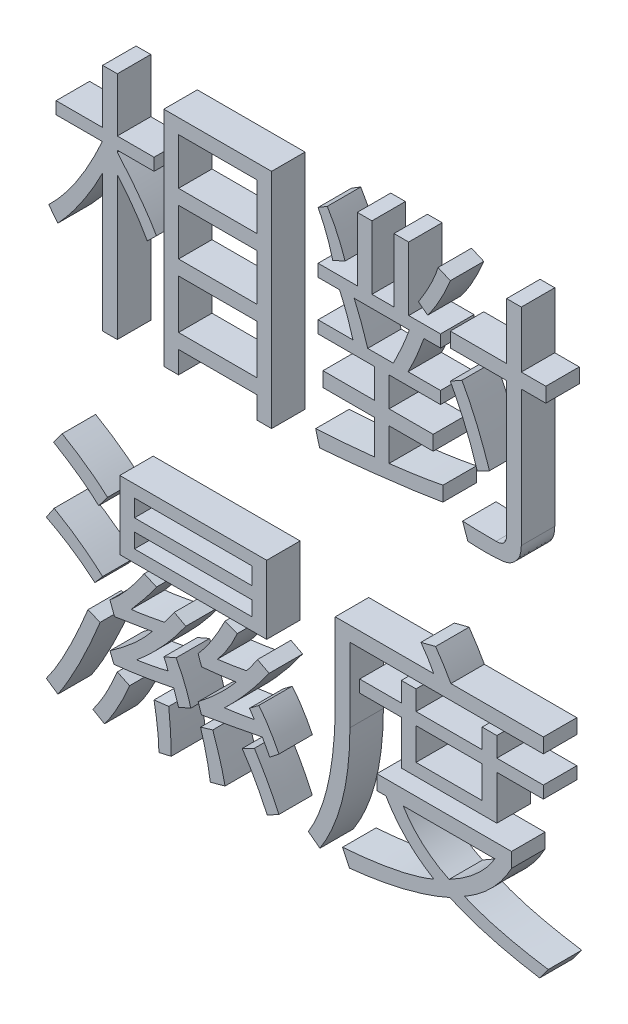
from build123d import *

# Parameters (mm, degrees)
EXTRUDE_1_DEPTH    = 3
SKETCH_2_W         = 7.024390244
SKETCH_2_H         = 4.170731708
SKETCH_2_H_2       = 4.390243903
EXTRUDE_1_2_DEPTH  = 3
EXTRUDE_1_3_DEPTH  = 3
EXTRUDE_1_4_DEPTH  = 3
EXTRUDE_1_5_DEPTH  = 3
EXTRUDE_1_6_DEPTH  = 3
EXTRUDE_1_7_DEPTH  = 3
EXTRUDE_1_8_DEPTH  = 3
SKETCH_2_W_2       = 13.170731708
SKETCH_2_H_3       = 6.146341463
SKETCH_2_W_3       = 10.536585366
SKETCH_2_H_4       = 1.536585365
SKETCH_2_H_5       = 1.317073171
EXTRUDE_1_9_DEPTH  = 3
EXTRUDE_1_10_DEPTH = 3
EXTRUDE_1_11_DEPTH = 3
EXTRUDE_1_12_DEPTH = 3
EXTRUDE_1_13_DEPTH = 3
EXTRUDE_1_14_DEPTH = 3
EXTRUDE_1_15_DEPTH = 3
EXTRUDE_1_16_DEPTH = 3
EXTRUDE_1_17_DEPTH = 3
EXTRUDE_1_18_DEPTH = 3
SKETCH_2_W_4       = 5.926829268
SKETCH_2_H_6       = 2.853658537
EXTRUDE_1_19_DEPTH = 3
EXTRUDE_1_20_DEPTH = 3


with BuildPart() as part:
    # 草圖2 → 填料-伸長1 (new body)
    with BuildSketch(Plane.XY):
        with BuildLine():
            Line((11.195121951, 8.492378049), (10.37195122, 7.682926829))
            add(Edge.make_bspline(
                [(10.37195122, 7.682926829), (10.194001007, 7.995110736), (9.828654537, 8.636050058), (9.192617307, 9.575460859), (8.478376217, 10.530055372), (7.952666495, 11.150939105), (7.682926829, 11.469512195)],
                knots=[0, 0, 0, 0, 0.926494149, 1.902168946, 2.923610835, 4, 4, 4, 4], degree=3))
            Line((7.682926829, 11.469512195), (7.682926829, -1.317073171))
            Line((7.682926829, -1.317073171), (6.365853659, -1.317073171))
            Line((6.365853659, -1.317073171), (6.365853659, 10.955030488))
            add(Edge.make_bspline(
                [(6.365853659, 10.955030488), (6.215695345, 10.664757037), (5.919445146, 10.092071011), (5.448191947, 9.262177755), (4.965376822, 8.468777478), (4.466566618, 7.714189973), (3.959301962, 6.9922869), (3.439571365, 6.306551586), (2.903589275, 5.659115278), (2.530613952, 5.250831327), (2.346036585, 5.048780488)],
                knots=[0, 0, 0, 0, 1.09419143, 2.15875114, 3.194770078, 4.203431801, 5.186928088, 6.148575884, 7.083770513, 8, 8, 8, 8], degree=3))
            Line((2.346036585, 5.048780488), (1.536585366, 6.091463415))
            add(Edge.make_bspline(
                [(1.536585366, 6.091463415), (1.759917396, 6.316467103), (2.215687975, 6.775649163), (2.861543167, 7.525851201), (3.491437342, 8.340136735), (4.094833622, 9.224938723), (4.691759287, 10.168014651), (5.261391283, 11.182375763), (5.819159698, 12.259265922), (6.165245336, 13.008121113), (6.341844512, 13.390243902)],
                knots=[0, 0, 0, 0, 0.865432811, 1.76615425, 2.700926786, 3.675112701, 4.689371464, 5.747644892, 6.850677372, 8, 8, 8, 8], degree=3))
            Line((6.341844512, 13.390243902), (2.195121951, 13.390243902))
            Line((2.195121951, 13.390243902), (2.195121951, 14.487804878))
            Line((2.195121951, 14.487804878), (6.365853659, 14.487804878))
            Line((6.365853659, 14.487804878), (6.365853659, 19.317073171))
            Line((6.365853659, 19.317073171), (7.682926829, 19.317073171))
            Line((7.682926829, 19.317073171), (7.682926829, 14.487804878))
            Line((7.682926829, 14.487804878), (10.975609756, 14.487804878))
            Line((10.975609756, 14.487804878), (10.975609756, 13.390243902))
            Line((10.975609756, 13.390243902), (7.682926829, 13.390243902))
            Line((7.682926829, 13.390243902), (7.682926829, 13.225609756))
            add(Edge.make_bspline(
                [(7.682926829, 13.225609756), (7.867915933, 13.013746523), (8.230737255, 12.598216651), (8.749747103, 11.972489826), (9.234615126, 11.358953316), (9.694165494, 10.763026288), (10.1136308, 10.175919212), (10.507113856, 9.605772744), (10.868089211, 9.048616748), (11.087786379, 8.674941418), (11.195121951, 8.492378049)],
                knots=[0, 0, 0, 0, 1.143459145, 2.242679984, 3.304712972, 4.322704541, 5.301803685, 6.237830081, 7.139071671, 8, 8, 8, 8], degree=3))
        make_face()
    extrude(amount=EXTRUDE_1_DEPTH)


with BuildPart() as body_2:
    # 草圖2 → Extrude 1 2 (new body)
    with BuildSketch(Plane.XY):
        Polygon((21.512195122, -1.317073171), (20.195121951, -1.317073171), (20.195121951, 0.658536585), (13.170731707, 0.658536585), (13.170731707, -1.317073171), (11.853658537, -1.317073171), (11.853658537, 18.658536585), (21.512195122, 18.658536585), align=None)
        with Locations((16.682926829, 15.256097561)):
            Rectangle(SKETCH_2_W, SKETCH_2_H, mode=Mode.SUBTRACT)
        with Locations((16.682926829, 9.768292683)):
            Rectangle(SKETCH_2_W, SKETCH_2_H, mode=Mode.SUBTRACT)
        with Locations((16.682926829, 4.170731708)):
            Rectangle(SKETCH_2_W, SKETCH_2_H_2, mode=Mode.SUBTRACT)
    extrude(amount=EXTRUDE_1_2_DEPTH)


with BuildPart() as body_3:
    # 草圖2 → Extrude 1 3 (new body)
    with BuildSketch(Plane.XY):
        with BuildLine():
            add(Edge.make_bspline(
                [(36.87804878, 0.658536585), (36.479239613, 0.592109643), (35.664311248, 0.456372544), (34.413150927, 0.272757679), (33.109447277, 0.098721548), (31.753467888, -0.069606956), (30.344788428, -0.230068855), (28.883781703, -0.384994037), (27.370008335, -0.529462451), (26.342700315, -0.615016395), (25.820121951, -0.658536585)],
                knots=[0, 0, 0, 0, 0.871065814, 1.779939626, 2.724368522, 3.704811522, 4.72380686, 5.778991205, 6.870201418, 8, 8, 8, 8], degree=3))
            Line((25.820121951, -0.658536585), (25.463414634, 0.658536585))
            add(Edge.make_bspline(
                [(25.463414634, 0.658536585), (25.870473505, 0.684110794), (26.706615328, 0.736642914), (27.992053677, 0.831510617), (29.340832205, 0.953832667), (30.260731458, 1.044355014), (30.731707317, 1.09070122)],
                knots=[0, 0, 0, 0, 0.92583437, 1.90176137, 2.925730468, 4, 4, 4, 4], degree=3))
            Line((30.731707317, 1.09070122), (30.731707317, 4.170731707))
            Line((30.731707317, 4.170731707), (26.12195122, 4.170731707))
            Line((26.12195122, 4.170731707), (26.12195122, 5.487804878))
            Line((26.12195122, 5.487804878), (30.731707317, 5.487804878))
            Line((30.731707317, 5.487804878), (30.731707317, 8.12195122))
            Line((30.731707317, 8.12195122), (25.682926829, 8.12195122))
            Line((25.682926829, 8.12195122), (25.682926829, 9.219512195))
            Line((25.682926829, 9.219512195), (28.81097561, 9.219512195))
            add(Edge.make_bspline(
                [(28.81097561, 9.219512195), (28.722233505, 9.522215625), (28.549049417, 10.112954568), (28.250347401, 10.962153868), (27.946901845, 11.761759944), (27.716095311, 12.266373839), (27.603658537, 12.512195122)],
                knots=[0, 0, 0, 0, 1.078020835, 2.10380467, 3.076273615, 4, 4, 4, 4], degree=3))
            Line((27.603658537, 12.512195122), (25.682926829, 12.512195122))
            Line((25.682926829, 12.512195122), (25.682926829, 13.609756098))
            Line((25.682926829, 13.609756098), (29.195121951, 13.609756098))
            Line((29.195121951, 13.609756098), (29.195121951, 19.317073171))
            Line((29.195121951, 19.317073171), (30.512195122, 19.317073171))
            Line((30.512195122, 19.317073171), (30.512195122, 13.609756098))
            Line((30.512195122, 13.609756098), (32.487804878, 13.609756098))
            Line((32.487804878, 13.609756098), (32.487804878, 19.317073171))
            Line((32.487804878, 19.317073171), (33.804878049, 19.317073171))
            Line((33.804878049, 19.317073171), (33.804878049, 13.609756098))
            Line((33.804878049, 13.609756098), (36.658536585, 13.609756098))
            Line((36.658536585, 13.609756098), (36.658536585, 12.512195122))
            Line((36.658536585, 12.512195122), (35.176829268, 12.512195122))
            add(Edge.make_bspline(
                [(35.176829268, 12.512195122), (35.072202937, 12.23256672), (34.863030097, 11.673523249), (34.518148298, 10.845603445), (34.149237498, 10.026346651), (33.883122969, 9.488545537), (33.75, 9.219512195)],
                knots=[0, 0, 0, 0, 0.997752604, 1.994744001, 2.996876897, 4, 4, 4, 4], degree=3))
            Line((33.75, 9.219512195), (36.658536585, 9.219512195))
            Line((36.658536585, 9.219512195), (36.658536585, 8.12195122))
            Line((36.658536585, 8.12195122), (32.048780488, 8.12195122))
            Line((32.048780488, 8.12195122), (32.048780488, 5.487804878))
            Line((32.048780488, 5.487804878), (36, 5.487804878))
            Line((36, 5.487804878), (36, 4.170731707))
            Line((36, 4.170731707), (32.048780488, 4.170731707))
            Line((32.048780488, 4.170731707), (32.048780488, 1.245045732))
            add(Edge.make_bspline(
                [(32.048780488, 1.245045732), (32.433165458, 1.288913096), (33.215646696, 1.378212605), (34.404286369, 1.549722353), (35.631027102, 1.742115455), (36.457681907, 1.896899601), (36.87804878, 1.975609756)],
                knots=[0, 0, 0, 0, 0.950226922, 1.934349145, 2.949584292, 4, 4, 4, 4], degree=3))
            Line((36.87804878, 1.975609756), (36.87804878, 0.658536585))
        make_face()
        with BuildLine():
            Line((33.859756098, 12.512195122), (28.920731707, 12.512195122))
            add(Edge.make_bspline(
                [(28.920731707, 12.512195122), (29.028453625, 12.258959869), (29.247963514, 11.742930785), (29.557869177, 10.940732841), (29.850643317, 10.095390577), (30.034489589, 9.514915436), (30.12804878, 9.219512195)],
                knots=[0, 0, 0, 0, 0.941091742, 1.917705787, 2.940322478, 4, 4, 4, 4], degree=3))
            Line((30.12804878, 9.219512195), (32.432926829, 9.219512195))
            add(Edge.make_bspline(
                [(32.432926829, 9.219512195), (32.584264269, 9.52974749), (32.873128727, 10.121907307), (33.262226073, 10.981368871), (33.590573188, 11.767604059), (33.773533973, 12.273694753), (33.859756098, 12.512195122)],
                knots=[0, 0, 0, 0, 1.153513399, 2.201762002, 3.152562119, 4, 4, 4, 4], degree=3))
        make_face(mode=Mode.SUBTRACT)
    extrude(amount=EXTRUDE_1_3_DEPTH)


with BuildPart() as body_4:
    # 草圖2 → Extrude 1 4 (new body)
    with BuildSketch(Plane.XY):
        with BuildLine():
            Line((46.097560976, 12.951219512), (43.902439024, 12.951219512))
            Line((43.902439024, 12.951219512), (43.902439024, 0.795731707))
            add(Edge.make_bspline(
                [(43.902439024, 0.795731707), (43.89874847, 0.663798036), (43.891715468, 0.412375126), (43.813850742, 0.057097246), (43.692685574, -0.257432277), (43.516873076, -0.522584136), (43.315622187, -0.744710865), (43.096501316, -0.924349749), (42.868006095, -1.069918931), (42.658115071, -1.154666328), (42.470236451, -1.204835945), (42.298050304, -1.234793709), (42.093866371, -1.256397329), (41.858680139, -1.282303045), (41.590878487, -1.298316512), (41.291212997, -1.307597972), (40.959633148, -1.314612526), (40.727518967, -1.31622911), (40.60632622, -1.317073171)],
                knots=[0, 0, 0, 0, 1.393959343, 2.656435708, 3.829226923, 4.940030392, 6.002126219, 6.990473935, 7.930543058, 8.858465568, 9.372067435, 9.986739113, 10.705586259, 11.54470175, 12.490360102, 13.543598056, 14.717449747, 16, 16, 16, 16], degree=3))
            add(Edge.make_bspline(
                [(40.60632622, -1.317073171), (40.346680538, -1.315475135), (39.846411552, -1.312396141), (39.347459424, -1.276183219), (39.107469512, -1.258765244)],
                knots=[0, 0, 0, 0, 1.038024297, 2, 2, 2, 2], degree=3))
            Line((39.107469512, -1.258765244), (38.634146341, 0.068597561))
            add(Edge.make_bspline(
                [(38.634146341, 0.068597561), (38.846761388, 0.057371155), (39.29696043, 0.033599945), (40.011742263, 0.015883439), (40.801762821, 0.000619343), (41.354029714, 0.000212337), (41.64214939, 0)],
                knots=[0, 0, 0, 0, 0.849009304, 1.797724023, 2.851064495, 4, 4, 4, 4], degree=3))
            add(Edge.make_bspline(
                [(41.64214939, 0), (41.715719876, 0.001550386), (41.855516521, 0.004496388), (42.049685822, 0.055650379), (42.220232086, 0.127261484), (42.353482251, 0.243273481), (42.459665489, 0.384276048), (42.535865329, 0.557498863), (42.579177844, 0.761595121), (42.583232144, 0.907557455), (42.585365854, 0.984375)],
                knots=[0, 0, 0, 0, 1.126045964, 2.139682047, 3.066887442, 3.939260296, 4.817270513, 5.760467651, 6.821371433, 8, 8, 8, 8], degree=3))
            Line((42.585365854, 0.984375), (42.585365854, 12.951219512))
            Line((42.585365854, 12.951219512), (37.536585366, 12.951219512))
            Line((37.536585366, 12.951219512), (37.536585366, 14.268292683))
            Line((37.536585366, 14.268292683), (42.585365854, 14.268292683))
            Line((42.585365854, 14.268292683), (42.585365854, 19.317073171))
            Line((42.585365854, 19.317073171), (43.902439024, 19.317073171))
            Line((43.902439024, 19.317073171), (43.902439024, 14.268292683))
            Line((43.902439024, 14.268292683), (46.097560976, 14.268292683))
            Line((46.097560976, 14.268292683), (46.097560976, 12.951219512))
        make_face()
    extrude(amount=EXTRUDE_1_4_DEPTH)


with BuildPart() as body_5:
    # 草圖2 → Extrude 1 5 (new body)
    with BuildSketch(Plane.XY):
        with BuildLine():
            add(Edge.make_bspline(
                [(37.536585366, 18.181783537), (37.393225684, 17.841483376), (37.111468153, 17.172661207), (36.624266309, 16.216216026), (36.097284623, 15.318753538), (35.701054348, 14.761828266), (35.506097561, 14.487804878)],
                knots=[0, 0, 0, 0, 1.048181086, 2.060083505, 3.045504817, 4, 4, 4, 4], degree=3))
            Line((35.506097561, 14.487804878), (34.682926829, 15.115472561))
            add(Edge.make_bspline(
                [(34.682926829, 15.115472561), (34.790381826, 15.285131256), (34.999827137, 15.615820563), (35.286869763, 16.110202132), (35.546893211, 16.584587488), (35.786635769, 17.034315201), (35.987126618, 17.469388445), (36.167523279, 17.88093305), (36.320356596, 18.273769925), (36.400440084, 18.533431415), (36.43902439, 18.658536585)],
                knots=[0, 0, 0, 0, 1.215130635, 2.368465142, 3.458389289, 4.488834968, 5.451365271, 6.356147849, 7.20799036, 8, 8, 8, 8], degree=3))
            Line((36.43902439, 18.658536585), (37.536585366, 18.181783537))
        make_face()
    extrude(amount=EXTRUDE_1_5_DEPTH)


with BuildPart() as body_6:
    # 草圖2 → Extrude 1 6 (new body)
    with BuildSketch(Plane.XY):
        with BuildLine():
            Line((28.097560976, 14.985137195), (27, 14.487804878))
            add(Edge.make_bspline(
                [(27, 14.487804878), (26.917764724, 14.788419731), (26.753744958, 15.388001574), (26.446077837, 16.264685579), (26.094883421, 17.119219593), (25.820136532, 17.66775252), (25.682926829, 17.941692073)],
                knots=[0, 0, 0, 0, 1.009354514, 2.013176112, 3.007772146, 4, 4, 4, 4], degree=3))
            Line((25.682926829, 17.941692073), (26.506097561, 18.43902439))
            add(Edge.make_bspline(
                [(26.506097561, 18.43902439), (26.66597493, 18.169879825), (26.987265848, 17.629004623), (27.412106667, 16.780899391), (27.783062226, 15.89720013), (27.992270199, 15.29048599), (28.097560976, 14.985137195)],
                knots=[0, 0, 0, 0, 0.985279188, 1.980025419, 2.983381524, 4, 4, 4, 4], degree=3))
        make_face()
    extrude(amount=EXTRUDE_1_6_DEPTH)


with BuildPart() as body_7:
    # 草圖2 → Extrude 1 7 (new body)
    with BuildSketch(Plane.XY):
        with BuildLine():
            Line((41.048780488, 5.179115854), (39.951219512, 4.609756098))
            add(Edge.make_bspline(
                [(39.951219512, 4.609756098), (39.799297043, 5.094275082), (39.49277485, 6.071851493), (38.920236977, 7.514672907), (38.282417195, 8.962844479), (37.786865716, 9.905931038), (37.536585366, 10.382240854)],
                knots=[0, 0, 0, 0, 0.971873337, 1.960873523, 2.970130635, 4, 4, 4, 4], degree=3))
            Line((37.536585366, 10.382240854), (38.579268293, 10.975609756))
            add(Edge.make_bspline(
                [(38.579268293, 10.975609756), (38.686623969, 10.781809619), (38.907212814, 10.383599204), (39.226462107, 9.760176378), (39.535346156, 9.093066827), (39.851476299, 8.390140547), (40.151182545, 7.642392048), (40.461226187, 6.859530137), (40.756023754, 6.032828235), (40.949912666, 5.467425818), (41.048780488, 5.179115854)],
                knots=[0, 0, 0, 0, 0.842606769, 1.73134444, 2.663122562, 3.638416779, 4.662315381, 5.726598791, 6.840747397, 8, 8, 8, 8], degree=3))
        make_face()
    extrude(amount=EXTRUDE_1_7_DEPTH)


with BuildPart() as body_8:
    # 草圖2 → Extrude 1 8 (new body)
    with BuildSketch(Plane.XY):
        with BuildLine():
            Line((6.804878049, -14.006097561), (6.016006098, -15.048780488))
            add(Edge.make_bspline(
                [(6.016006098, -15.048780488), (5.895685002, -14.936910658), (5.645839613, -14.704614225), (5.240864995, -14.363749041), (4.796502529, -14.013374166), (4.313142114, -13.651959296), (3.784045473, -13.287983824), (3.219093738, -12.910187991), (2.613155357, -12.524526019), (2.192245081, -12.270821356), (1.975609756, -12.140243902)],
                knots=[0, 0, 0, 0, 0.790397559, 1.641251557, 2.545903749, 3.512977392, 4.544534932, 5.635403711, 6.782982706, 8, 8, 8, 8], degree=3))
            Line((1.975609756, -12.140243902), (2.740472561, -11.097560976))
            add(Edge.make_bspline(
                [(2.740472561, -11.097560976), (3.131847794, -11.331200457), (3.891441595, -11.784655571), (4.954330216, -12.513844259), (5.928662336, -13.23811268), (6.518751932, -13.75531396), (6.804878049, -14.006097561)],
                knots=[0, 0, 0, 0, 1.09226414, 2.11990182, 3.088366926, 4, 4, 4, 4], degree=3))
        make_face()
    extrude(amount=EXTRUDE_1_8_DEPTH)


with BuildPart() as body_9:
    # 草圖2 → Extrude 1 9 (new body)
    with BuildSketch(Plane.XY):
        with Locations((14.487804878, -14.829268293)):
            Rectangle(SKETCH_2_W_2, SKETCH_2_H_3)
        with Locations((14.487804878, -13.62195122)):
            Rectangle(SKETCH_2_W_3, SKETCH_2_H_4, mode=Mode.SUBTRACT)
        with Locations((14.487804878, -16.146341464)):
            Rectangle(SKETCH_2_W_3, SKETCH_2_H_5, mode=Mode.SUBTRACT)
    extrude(amount=EXTRUDE_1_9_DEPTH)


with BuildPart() as body_10:
    # 草圖2 → Extrude 1 10 (new body)
    with BuildSketch(Plane.XY):
        with BuildLine():
            Line((6.365853659, -20.37195122), (5.669588415, -21.195121951))
            add(Edge.make_bspline(
                [(5.669588415, -21.195121951), (5.34266575, -20.921971199), (4.683540255, -20.371258002), (3.622555842, -19.621086691), (2.502574085, -18.914688921), (1.715503577, -18.497682254), (1.317073171, -18.286585366)],
                knots=[0, 0, 0, 0, 0.973940654, 1.963611541, 2.969140539, 4, 4, 4, 4], degree=3))
            Line((1.317073171, -18.286585366), (2.023628049, -17.243902439))
            add(Edge.make_bspline(
                [(2.023628049, -17.243902439), (2.410462708, -17.472874497), (3.181893601, -17.929493663), (4.28872953, -18.689142947), (5.356685602, -19.495819145), (6.029494972, -20.079933818), (6.365853659, -20.37195122)],
                knots=[0, 0, 0, 0, 1.005963703, 2.006106376, 3.003189505, 4, 4, 4, 4], degree=3))
        make_face()
    extrude(amount=EXTRUDE_1_10_DEPTH)


with BuildPart() as body_11:
    # 草圖2 → Extrude 1 11 (new body)
    with BuildSketch(Plane.XY):
        with BuildLine():
            Line((14.268292683, -26.645198171), (13.170731707, -27.12195122))
            add(Edge.make_bspline(
                [(13.170731707, -27.12195122), (13.130175931, -26.986851776), (13.054378028, -26.734353728), (12.939942123, -26.38525642), (12.842780112, -26.089017729), (12.775703918, -25.912151551), (12.745426829, -25.832317073)],
                knots=[0, 0, 0, 0, 1.246138474, 2.329006878, 3.245741243, 4, 4, 4, 4], degree=3))
            add(Edge.make_bspline(
                [(12.745426829, -25.832317073), (12.289780384, -25.925467503), (11.386429348, -26.110144763), (10.034523774, -26.335028498), (8.703276932, -26.536368529), (7.819350368, -26.634348257), (7.381097561, -26.682926829)],
                knots=[0, 0, 0, 0, 1.027005234, 2.036109911, 3.026298815, 4, 4, 4, 4], degree=3))
            Line((7.381097561, -26.682926829), (7.024390244, -25.804878049))
            add(Edge.make_bspline(
                [(7.024390244, -25.804878049), (7.223226392, -25.665689168), (7.613907099, -25.392205644), (8.170650634, -24.965535427), (8.698556491, -24.543428761), (9.191350708, -24.119939771), (9.648737467, -23.693937638), (10.070676626, -23.267068993), (10.46399082, -22.845044627), (10.70162726, -22.55240456), (10.817835366, -22.40929878)],
                knots=[0, 0, 0, 0, 1.140042612, 2.239998397, 3.294336047, 4.314948586, 5.291554596, 6.229593053, 7.134242047, 8, 8, 8, 8], degree=3))
            Line((10.817835366, -22.40929878), (7.429115854, -22.951219512))
            Line((7.429115854, -22.951219512), (7.024390244, -21.853658537))
            add(Edge.make_bspline(
                [(7.024390244, -21.853658537), (7.152313597, -21.745052012), (7.414656721, -21.522323523), (7.79783094, -21.157989708), (8.180891497, -20.759640102), (8.566276423, -20.330305797), (8.948983289, -19.866741708), (9.334215912, -19.372162714), (9.718438798, -18.842790687), (9.969310834, -18.474739516), (10.097560976, -18.286585366)],
                knots=[0, 0, 0, 0, 0.852319151, 1.74792221, 2.684397488, 3.659152232, 4.677899211, 5.737400043, 6.843319611, 8, 8, 8, 8], degree=3))
            Line((10.097560976, -18.286585366), (11.195121951, -18.773628049))
            add(Edge.make_bspline(
                [(11.195121951, -18.773628049), (11.159096052, -18.832302304), (11.074933034, -18.969375978), (10.913801312, -19.195690905), (10.706272595, -19.47515602), (10.446004087, -19.804440347), (10.142346905, -20.189661197), (9.783284628, -20.623586416), (9.381307352, -21.115020226), (9.090981676, -21.455201443), (8.938262195, -21.634146341)],
                knots=[0, 0, 0, 0, 0.453096944, 1.058516412, 1.827631533, 2.744419089, 3.820990896, 5.056301648, 6.451531779, 8, 8, 8, 8], degree=3))
            add(Edge.make_bspline(
                [(8.938262195, -21.634146341), (9.017181851, -21.627647173), (9.187833605, -21.613593709), (9.462494439, -21.58275179), (9.775404808, -21.536325971), (10.127633629, -21.4819738), (10.518611773, -21.416477587), (10.947298697, -21.340698056), (11.415245567, -21.255496404), (11.739420585, -21.191026189), (11.908536585, -21.157393293)],
                knots=[0, 0, 0, 0, 0.631425652, 1.365361961, 2.20340383, 3.153685227, 4.207324198, 5.364426221, 6.625070808, 8, 8, 8, 8], degree=3))
            add(Edge.make_bspline(
                [(11.908536585, -21.157393293), (11.997958516, -21.038673594), (12.167589286, -20.813465819), (12.403528526, -20.492473664), (12.607394408, -20.20683532), (12.729715531, -20.026881181), (12.786585366, -19.943216463)],
                knots=[0, 0, 0, 0, 1.19014648, 2.257672853, 3.189953014, 4, 4, 4, 4], degree=3))
            Line((12.786585366, -19.943216463), (13.829268293, -20.498856707))
            add(Edge.make_bspline(
                [(13.829268293, -20.498856707), (13.674409408, -20.718534256), (13.364576764, -21.158052312), (12.867406481, -21.794393447), (12.353846024, -22.421842479), (11.810628715, -23.029815793), (11.248344837, -23.629558301), (10.658591051, -24.210049026), (10.047660476, -24.77859228), (9.624343477, -25.142031459), (9.411585366, -25.324695122)],
                knots=[0, 0, 0, 0, 0.982953296, 1.966635754, 2.952910358, 3.948221883, 4.94812618, 5.95943845, 6.974418644, 8, 8, 8, 8], degree=3))
            add(Edge.make_bspline(
                [(9.411585366, -25.324695122), (9.56707735, -25.29957108), (9.867854461, -25.250972198), (10.302726179, -25.180234696), (10.705198944, -25.108095674), (11.073113997, -25.035951746), (11.408554335, -24.968140028), (11.708849342, -24.898800028), (11.978260513, -24.835123564), (12.14533923, -24.787887775), (12.224085366, -24.765625)],
                knots=[0, 0, 0, 0, 1.317536546, 2.54858691, 3.685391053, 4.737587821, 5.68475564, 6.547800657, 7.315561622, 8, 8, 8, 8], degree=3))
            add(Edge.make_bspline(
                [(12.224085366, -24.765625), (12.193572644, -24.671776705), (12.136336043, -24.495733499), (12.05040038, -24.249174772), (11.953115726, -24.043551291), (11.885080603, -23.920430494), (11.853658537, -23.863567073)],
                knots=[0, 0, 0, 0, 1.211754691, 2.273042671, 3.202403625, 4, 4, 4, 4], degree=3))
            Line((11.853658537, -23.863567073), (12.951219512, -23.390243902))
            add(Edge.make_bspline(
                [(12.951219512, -23.390243902), (13.091283222, -23.647802112), (13.371063731, -24.16228061), (13.718693732, -24.969343605), (14.031742022, -25.793174796), (14.189182344, -26.360253466), (14.268292683, -26.645198171)],
                knots=[0, 0, 0, 0, 0.998776884, 1.99507999, 2.992571276, 4, 4, 4, 4], degree=3))
        make_face()
    extrude(amount=EXTRUDE_1_11_DEPTH)


with BuildPart() as body_12:
    # 草圖2 → Extrude 1 12 (new body)
    with BuildSketch(Plane.XY):
        with BuildLine():
            Line((22.170731707, -26.254192073), (21.347560976, -26.902439024))
            Line((21.347560976, -26.902439024), (20.68902439, -25.674542683))
            add(Edge.make_bspline(
                [(20.68902439, -25.674542683), (20.391891489, -25.733492164), (19.817407046, -25.847466617), (18.984030877, -26.001995168), (18.212273827, -26.153099485), (17.499003518, -26.280362285), (16.846749556, -26.402352363), (16.253324972, -26.508425758), (15.719427044, -26.601212096), (15.383037243, -26.65683349), (15.225228659, -26.682926829)],
                knots=[0, 0, 0, 0, 1.308450527, 2.52979212, 3.661039907, 4.705226898, 5.659308597, 6.527258405, 7.309101332, 8, 8, 8, 8], degree=3))
            Line((15.225228659, -26.682926829), (14.937118902, -25.804878049))
            add(Edge.make_bspline(
                [(14.937118902, -25.804878049), (15.250163932, -25.559463233), (15.872295357, -25.071737013), (16.744357185, -24.275884112), (17.577173779, -23.453884345), (18.085991327, -22.866602036), (18.339557927, -22.573932927)],
                knots=[0, 0, 0, 0, 1.015027455, 2.017219306, 3.011891471, 4, 4, 4, 4], degree=3))
            add(Edge.make_bspline(
                [(18.339557927, -22.573932927), (18.244660157, -22.588752856), (18.044645104, -22.619988668), (17.729695775, -22.670088159), (17.384760833, -22.711173581), (17.011390823, -22.761843025), (16.609876899, -22.808246328), (16.178925835, -22.856929713), (15.719293016, -22.904820084), (15.402459783, -22.935424932), (15.238948171, -22.951219512)],
                knots=[0, 0, 0, 0, 0.737893124, 1.55524974, 2.449670796, 3.406192835, 4.449879139, 5.554643363, 6.737997893, 8, 8, 8, 8], degree=3))
            Line((15.238948171, -22.951219512), (14.926829268, -22.073170732))
            add(Edge.make_bspline(
                [(14.926829268, -22.073170732), (15.030768115, -21.953997888), (15.242814859, -21.710872106), (15.548947135, -21.320150888), (15.85239793, -20.899668984), (16.155779398, -20.447953065), (16.455821517, -19.965886762), (16.755355303, -19.452281573), (17.052895395, -18.909088461), (17.24413463, -18.532913097), (17.341463415, -18.341463415)],
                knots=[0, 0, 0, 0, 0.851293495, 1.736732884, 2.671307665, 3.642760826, 4.665888274, 5.727994635, 6.843691672, 8, 8, 8, 8], degree=3))
            Line((17.341463415, -18.341463415), (18.43902439, -18.766768293))
            add(Edge.make_bspline(
                [(18.43902439, -18.766768293), (18.317042263, -19.031627329), (18.075716971, -19.555615438), (17.65128078, -20.300853512), (17.182349964, -21.001475439), (16.830426883, -21.433238667), (16.655487805, -21.647865854)],
                knots=[0, 0, 0, 0, 1.028686851, 2.035119074, 3.023268221, 4, 4, 4, 4], degree=3))
            add(Edge.make_bspline(
                [(16.655487805, -21.647865854), (17.076719721, -21.592790376), (17.941955873, -21.479661971), (18.800860632, -21.325618836), (19.241615854, -21.246570122)],
                knots=[0, 0, 0, 0, 0.973680804, 2, 2, 2, 2], degree=3))
            add(Edge.make_bspline(
                [(19.241615854, -21.246570122), (19.268323945, -21.219504085), (19.327539721, -21.159494688), (19.416591566, -21.049702255), (19.522012194, -20.917304199), (19.643198491, -20.759943026), (19.77137362, -20.572646757), (19.919705186, -20.364835236), (20.081457272, -20.130799207), (20.191944943, -19.965109436), (20.25, -19.87804878)],
                knots=[0, 0, 0, 0, 0.535966828, 1.188317497, 1.991580308, 2.923535453, 3.988168681, 5.191497644, 6.524289967, 8, 8, 8, 8], degree=3))
            Line((20.25, -19.87804878), (21.292682927, -20.42339939))
            add(Edge.make_bspline(
                [(21.292682927, -20.42339939), (20.988908254, -20.842409807), (20.383566758, -21.677385251), (19.410157839, -22.876435786), (18.380771116, -24.020074506), (17.655726901, -24.743640012), (17.293445122, -25.105182927)],
                knots=[0, 0, 0, 0, 1.00706062, 2.006801875, 3.004061618, 4, 4, 4, 4], degree=3))
            add(Edge.make_bspline(
                [(17.293445122, -25.105182927), (17.529109594, -25.075362256), (17.993050519, -25.016655785), (18.674158163, -24.912194234), (19.33108237, -24.804470704), (19.758574126, -24.72094391), (19.96875, -24.679878049)],
                knots=[0, 0, 0, 0, 1.051996469, 2.071013125, 3.051615621, 4, 4, 4, 4], degree=3))
            add(Edge.make_bspline(
                [(19.96875, -24.679878049), (19.935319613, -24.630898493), (19.854677472, -24.512748016), (19.755442151, -24.353999186), (19.672859417, -24.214852233), (19.616481846, -24.127012489), (19.573349547, -24.062693126), (19.546986059, -24.028120857), (19.536585366, -24.014481707)],
                knots=[0, 0, 0, 0, 1.344806216, 3.243996286, 4.244528133, 5.014139586, 5.61106697, 6, 6, 6, 6], degree=3))
            Line((19.536585366, -24.014481707), (20.359756098, -23.390243902))
            add(Edge.make_bspline(
                [(20.359756098, -23.390243902), (20.519494917, -23.586853577), (20.851682152, -23.995716148), (21.305497849, -24.67830764), (21.754041633, -25.434697473), (22.028613184, -25.974690906), (22.170731707, -26.254192073)],
                knots=[0, 0, 0, 0, 0.894550579, 1.860275952, 2.892476588, 4, 4, 4, 4], degree=3))
        make_face()
    extrude(amount=EXTRUDE_1_12_DEPTH)


with BuildPart() as body_13:
    # 草圖2 → Extrude 1 13 (new body)
    with BuildSketch(Plane.XY):
        with BuildLine():
            add(Edge.make_bspline(
                [(6.146341463, -24.038490854), (5.995846728, -24.406145271), (5.699697497, -25.129629532), (5.236898904, -26.18366434), (4.770196084, -27.189920888), (4.300153355, -28.148799675), (3.825345427, -29.059725148), (3.342703536, -29.92185882), (2.863623224, -30.739889048), (2.525270902, -31.258501078), (2.359756098, -31.512195122)],
                knots=[0, 0, 0, 0, 1.136114451, 2.235688966, 3.29189904, 4.308207463, 5.289551844, 6.229290596, 7.133806387, 8, 8, 8, 8], degree=3))
            Line((2.359756098, -31.512195122), (1.317073171, -30.805640244))
            add(Edge.make_bspline(
                [(1.317073171, -30.805640244), (1.470793025, -30.587260967), (1.789927025, -30.133889133), (2.252027074, -29.407276765), (2.710164651, -28.606895661), (3.176308303, -27.741978758), (3.640797066, -26.805400844), (4.117149819, -25.805374932), (4.582957918, -24.730405888), (4.890836154, -23.989729709), (5.048780488, -23.609756098)],
                knots=[0, 0, 0, 0, 0.788833665, 1.637678124, 2.542530736, 3.512630171, 4.539700132, 5.630474507, 6.784411886, 8, 8, 8, 8], degree=3))
            Line((5.048780488, -23.609756098), (6.146341463, -24.038490854))
        make_face()
    extrude(amount=EXTRUDE_1_13_DEPTH)


with BuildPart() as body_14:
    # 草圖2 → Extrude 1 14 (new body)
    with BuildSketch(Plane.XY):
        with BuildLine():
            Line((22.170731707, -30.946265244), (21.12804878, -31.512195122))
            add(Edge.make_bspline(
                [(21.12804878, -31.512195122), (20.94241239, -31.121970611), (20.584941287, -30.370533967), (20.019713061, -29.308247956), (19.462405146, -28.345113877), (19.067327295, -27.752354834), (18.87804878, -27.468368902)],
                knots=[0, 0, 0, 0, 1.119201725, 2.155193139, 3.116168364, 4, 4, 4, 4], degree=3))
            Line((18.87804878, -27.468368902), (19.975609756, -26.902439024))
            add(Edge.make_bspline(
                [(19.975609756, -26.902439024), (20.184648324, -27.240733634), (20.598245073, -27.910072085), (21.174190426, -28.923298811), (21.696813542, -29.933744673), (22.0139824, -30.611372198), (22.170731707, -30.946265244)],
                knots=[0, 0, 0, 0, 1.0362788, 2.050346728, 3.036453954, 4, 4, 4, 4], degree=3))
        make_face()
    extrude(amount=EXTRUDE_1_14_DEPTH)


with BuildPart() as body_15:
    # 草圖2 → Extrude 1 15 (new body)
    with BuildSketch(Plane.XY):
        with BuildLine():
            add(Edge.make_bspline(
                [(8.780487805, -27.643292683), (8.696705307, -27.841433694), (8.531225017, -28.232785499), (8.272488633, -28.805020611), (8.000176786, -29.350627601), (7.721896599, -29.873112449), (7.437832926, -30.373345002), (7.147831411, -30.851069428), (6.84435068, -31.301353254), (6.634258998, -31.589421122), (6.530487805, -31.731707317)],
                knots=[0, 0, 0, 0, 1.103479291, 2.179501406, 3.22071246, 4.230788488, 5.215694843, 6.171196475, 7.096693785, 8, 8, 8, 8], degree=3))
            Line((6.530487805, -31.731707317), (5.487804878, -31.117759146))
            add(Edge.make_bspline(
                [(5.487804878, -31.117759146), (5.582834847, -30.991769822), (5.778131931, -30.732847845), (6.054462545, -30.315402823), (6.330936578, -29.866198744), (6.611839275, -29.386332065), (6.878892614, -28.867045753), (7.151993047, -28.316897737), (7.421901383, -27.73243358), (7.594748662, -27.328180981), (7.682926829, -27.12195122)],
                knots=[0, 0, 0, 0, 0.828369581, 1.702390988, 2.626896074, 3.5977655, 4.620697854, 5.691790416, 6.822465183, 8, 8, 8, 8], degree=3))
            Line((7.682926829, -27.12195122), (8.780487805, -27.643292683))
        make_face()
    extrude(amount=EXTRUDE_1_15_DEPTH)


with BuildPart() as body_16:
    # 草圖2 → Extrude 1 16 (new body)
    with BuildSketch(Plane.XY):
        with BuildLine():
            Line((17.341463415, -31.155487805), (16.024390244, -31.512195122))
            add(Edge.make_bspline(
                [(16.024390244, -31.512195122), (15.978703951, -31.221387522), (15.883910609, -30.61799813), (15.689579886, -29.687542851), (15.441149839, -28.699997801), (15.246725845, -28.025728206), (15.146341463, -27.677591463)],
                knots=[0, 0, 0, 0, 0.897088962, 1.861347377, 2.895777647, 4, 4, 4, 4], degree=3))
            Line((15.146341463, -27.677591463), (16.243902439, -27.341463415))
            add(Edge.make_bspline(
                [(16.243902439, -27.341463415), (16.308727706, -27.527552445), (16.435641704, -27.89187494), (16.607846844, -28.429390772), (16.771415962, -28.940534279), (16.914702, -29.429357409), (17.046364559, -29.894089889), (17.157589122, -30.336262861), (17.260324013, -30.752650961), (17.314939919, -31.023805281), (17.341463415, -31.155487805)],
                knots=[0, 0, 0, 0, 1.190670151, 2.331077327, 3.410423057, 4.43342439, 5.408951324, 6.328831069, 7.188418823, 8, 8, 8, 8], degree=3))
        make_face()
    extrude(amount=EXTRUDE_1_16_DEPTH)


with BuildPart() as body_17:
    # 草圖2 → Extrude 1 17 (new body)
    with BuildSketch(Plane.XY):
        with BuildLine():
            Line((12.512195122, -31.261814024), (11.414634146, -31.512195122))
            add(Edge.make_bspline(
                [(11.414634146, -31.512195122), (11.404526048, -31.227380748), (11.383384471, -30.63167768), (11.299586511, -29.70194769), (11.159024066, -28.699385724), (11.038304156, -28.008799759), (10.975609756, -27.650152439)],
                knots=[0, 0, 0, 0, 0.878797712, 1.838048009, 2.877216847, 4, 4, 4, 4], degree=3))
            Line((10.975609756, -27.650152439), (12.292682927, -27.492378049))
            add(Edge.make_bspline(
                [(12.292682927, -27.492378049), (12.326402705, -27.829500864), (12.39217918, -28.487119371), (12.459943197, -29.452422934), (12.503745479, -30.371922347), (12.509426476, -30.970228289), (12.512195122, -31.261814024)],
                knots=[0, 0, 0, 0, 1.076240785, 2.099400651, 3.073738666, 4, 4, 4, 4], degree=3))
        make_face()
    extrude(amount=EXTRUDE_1_17_DEPTH)


with BuildPart() as body_18:
    # 草圖2 → Extrude 1 18 (new body)
    with BuildSketch(Plane.XY):
        with BuildLine():
            Line((45.87804878, -14.390243902), (28.536585366, -14.390243902))
            Line((28.536585366, -14.390243902), (28.536585366, -21.030487805))
            add(Edge.make_bspline(
                [(28.536585366, -21.030487805), (28.534543782, -21.298039914), (28.530511577, -21.826465405), (28.500424031, -22.610124807), (28.443087202, -23.374915278), (28.374386089, -24.123529716), (28.275399292, -24.853770188), (28.16507166, -25.56835371), (28.027014288, -26.263601493), (27.86872498, -26.941851062), (27.691184124, -27.602171432), (27.493039275, -28.245926096), (27.267847576, -28.86901979), (27.030161302, -29.478517205), (26.763778437, -30.067019524), (26.483849344, -30.642080787), (26.179620382, -31.197439877), (25.957807258, -31.554326408), (25.847560976, -31.731707317)],
                knots=[0, 0, 0, 0, 1.148325744, 2.26798659, 3.365054226, 4.439725844, 5.493902812, 6.527318512, 7.542587444, 8.535264306, 9.516081912, 10.476808831, 11.425124757, 12.359113687, 13.283827267, 14.196748223, 15.103741917, 16, 16, 16, 16], degree=3))
            Line((25.847560976, -31.731707317), (24.804878049, -30.946265244))
            add(Edge.make_bspline(
                [(24.804878049, -30.946265244), (24.903886219, -30.780369507), (25.105118121, -30.443190114), (25.375843621, -29.912754797), (25.63187461, -29.357004831), (25.867548132, -28.775546619), (26.083118671, -28.166191733), (26.283139119, -27.531797597), (26.459205579, -26.869581227), (26.62230459, -26.182749289), (26.760529221, -25.469377526), (26.885791958, -24.730955622), (26.986639941, -23.965321761), (27.073776869, -23.173003955), (27.136860509, -22.353868076), (27.186129282, -21.508889612), (27.212793281, -20.63736759), (27.217249845, -20.047272095), (27.219512195, -19.747713415)],
                knots=[0, 0, 0, 0, 0.799538782, 1.625044783, 2.463633506, 3.331930801, 4.221090951, 5.138652757, 6.084627713, 7.056943804, 8.060278045, 9.091964495, 10.15685417, 11.256481478, 12.391154884, 13.557272111, 14.759962836, 16, 16, 16, 16], degree=3))
            Line((27.219512195, -19.747713415), (27.219512195, -13.073170732))
            Line((27.219512195, -13.073170732), (36.054878049, -13.073170732))
            add(Edge.make_bspline(
                [(36.054878049, -13.073170732), (35.880115694, -12.745259007), (35.536461363, -12.100450324), (35.111359241, -11.506217723), (34.902439024, -11.214176829)],
                knots=[0, 0, 0, 0, 1.017082223, 2, 2, 2, 2], degree=3))
            Line((34.902439024, -11.214176829), (36.219512195, -10.87804878))
            add(Edge.make_bspline(
                [(36.219512195, -10.87804878), (36.353521997, -11.071489714), (36.614331721, -11.447964238), (36.971111777, -12.011316793), (37.301755569, -12.545428139), (37.496862498, -12.900842182), (37.591463415, -13.073170732)],
                knots=[0, 0, 0, 0, 1.090206407, 2.121758468, 3.089302616, 4, 4, 4, 4], degree=3))
            Line((37.591463415, -13.073170732), (45.87804878, -13.073170732))
            Line((45.87804878, -13.073170732), (45.87804878, -14.390243902))
        make_face()
    extrude(amount=EXTRUDE_1_18_DEPTH)


with BuildPart() as body_19:
    # 草圖2 → Extrude 1 19 (new body)
    with BuildSketch(Plane.XY):
        Polygon((45.87804878, -17.902439024), (41.707317073, -17.902439024), (41.707317073, -21.853658537), (33.146341463, -21.853658537), (33.146341463, -17.902439024), (29.414634146, -17.902439024), (29.414634146, -16.804878049), (33.146341463, -16.804878049), (33.146341463, -15.048780488), (34.463414634, -15.048780488), (34.463414634, -16.804878049), (40.390243902, -16.804878049), (40.390243902, -15.048780488), (41.707317073, -15.048780488), (41.707317073, -16.804878049), (45.87804878, -16.804878049), align=None)
        with Locations((37.426829268, -19.329268293)):
            Rectangle(SKETCH_2_W_4, SKETCH_2_H_6, mode=Mode.SUBTRACT)
    extrude(amount=EXTRUDE_1_19_DEPTH)


with BuildPart() as body_20:
    # 草圖2 → Extrude 1 20 (new body)
    with BuildSketch(Plane.XY):
        with BuildLine():
            Line((46.317073171, -30.908536585), (45.552210366, -31.951219512))
            add(Edge.make_bspline(
                [(45.552210366, -31.951219512), (45.151660547, -31.884839238), (44.368188973, -31.755000062), (43.223644607, -31.526816498), (42.133285061, -31.281425278), (41.096911132, -31.014004526), (40.115767939, -30.72798833), (39.191637334, -30.416427905), (38.317623448, -30.096171862), (37.762933849, -29.851565733), (37.491996951, -29.732088415)],
                knots=[0, 0, 0, 0, 1.162184872, 2.273222379, 3.340311393, 4.361127026, 5.336680946, 6.265028051, 7.152556821, 8, 8, 8, 8], degree=3))
            add(Edge.make_bspline(
                [(37.491996951, -29.732088415), (37.176687407, -29.869276343), (36.536621654, -30.147762346), (35.534193472, -30.508022637), (34.484783846, -30.837066462), (33.384026563, -31.132499157), (32.232596241, -31.391330555), (31.030536277, -31.618318084), (29.778707478, -31.806750661), (28.925650472, -31.902529908), (28.491996951, -31.951219512)],
                knots=[0, 0, 0, 0, 0.886387415, 1.799330969, 2.744702464, 3.721465897, 4.7369433, 5.786852254, 6.874941176, 8, 8, 8, 8], degree=3))
            Line((28.491996951, -31.951219512), (27.87804878, -30.634146341))
            add(Edge.make_bspline(
                [(27.87804878, -30.634146341), (28.303604523, -30.600188955), (29.130672236, -30.534192764), (30.333507149, -30.39442276), (31.465380273, -30.23640841), (32.525606012, -30.047254703), (33.515987218, -29.836387039), (34.434335551, -29.597830166), (35.282194177, -29.332390149), (35.814652709, -29.125525702), (36.072027439, -29.025533537)],
                knots=[0, 0, 0, 0, 1.222196013, 2.375338318, 3.4664561, 4.493829593, 5.458162206, 6.364860153, 7.209621685, 8, 8, 8, 8], degree=3))
            add(Edge.make_bspline(
                [(36.072027439, -29.025533537), (35.843510225, -28.884684886), (35.390637626, -28.605552765), (34.754690067, -28.134225534), (34.151572639, -27.643241517), (33.594704133, -27.114725482), (33.076449725, -26.559581082), (32.596945101, -25.974279085), (32.160190815, -25.357486353), (31.903008092, -24.924069924), (31.774390244, -24.707317073)],
                knots=[0, 0, 0, 0, 1.045222006, 2.071408091, 3.080726779, 4.073121226, 5.059421033, 6.037400383, 7.018498066, 8, 8, 8, 8], degree=3))
            Line((31.774390244, -24.707317073), (30.951219512, -24.707317073))
            Line((30.951219512, -24.707317073), (30.951219512, -23.390243902))
            Line((30.951219512, -23.390243902), (43.024390244, -23.390243902))
            Line((43.024390244, -23.390243902), (43.024390244, -24.707317073))
            add(Edge.make_bspline(
                [(43.024390244, -24.707317073), (42.900916941, -24.927795698), (42.655591378, -25.365858355), (42.227671099, -25.983973486), (41.767031108, -26.573475607), (41.254844864, -27.122103439), (40.706196147, -27.642880812), (40.110607231, -28.125309094), (39.475985792, -28.57784272), (39.025992303, -28.84569865), (38.798780488, -28.980945122)],
                knots=[0, 0, 0, 0, 0.99520698, 1.977348207, 2.958838301, 3.940721194, 4.931830994, 5.937263389, 6.958477976, 8, 8, 8, 8], degree=3))
            add(Edge.make_bspline(
                [(38.798780488, -28.980945122), (39.03335673, -29.080520252), (39.52064562, -29.287369223), (40.297227335, -29.5607605), (41.138438535, -29.826557966), (42.04695684, -30.070004758), (43.020031506, -30.304283268), (44.058928722, -30.521733112), (45.16427109, -30.729601827), (45.925705979, -30.84778965), (46.317073171, -30.908536585)],
                knots=[0, 0, 0, 0, 0.785703529, 1.632154207, 2.537618949, 3.505813344, 4.531999153, 5.623870825, 6.778701875, 8, 8, 8, 8], degree=3))
        make_face()
        with BuildLine():
            Line((41.532393293, -24.707317073), (33.31097561, -24.707317073))
            add(Edge.make_bspline(
                [(33.31097561, -24.707317073), (33.438167296, -24.903899109), (33.69103892, -25.294726686), (34.124546139, -25.839285596), (34.586500748, -26.352404819), (35.086773015, -26.826444144), (35.618341541, -27.267266266), (36.187511771, -27.667951359), (36.787745862, -28.039501115), (37.212369198, -28.250261016), (37.426829268, -28.356707317)],
                knots=[0, 0, 0, 0, 1.007124876, 2.002279464, 2.991578142, 3.976498909, 4.965589554, 5.960841449, 6.9701035, 8, 8, 8, 8], degree=3))
            add(Edge.make_bspline(
                [(37.426829268, -28.356707317), (37.656012868, -28.2314965), (38.104578104, -27.986430013), (38.73690462, -27.577514389), (39.326308005, -27.154294639), (39.862741708, -26.704826401), (40.355164772, -26.23936171), (40.797814389, -25.753134588), (41.192484777, -25.243642203), (41.419631252, -24.885238818), (41.532393293, -24.707317073)],
                knots=[0, 0, 0, 0, 1.126694466, 2.205201292, 3.247398746, 4.256279667, 5.22300528, 6.16957637, 7.091325081, 8, 8, 8, 8], degree=3))
        make_face(mode=Mode.SUBTRACT)
    extrude(amount=EXTRUDE_1_20_DEPTH)


solid = Compound([part.part, body_2.part, body_3.part, body_4.part, body_5.part, body_6.part, body_7.part, body_8.part, body_9.part, body_10.part, body_11.part, body_12.part, body_13.part, body_14.part, body_15.part, body_16.part, body_17.part, body_18.part, body_19.part, body_20.part])
